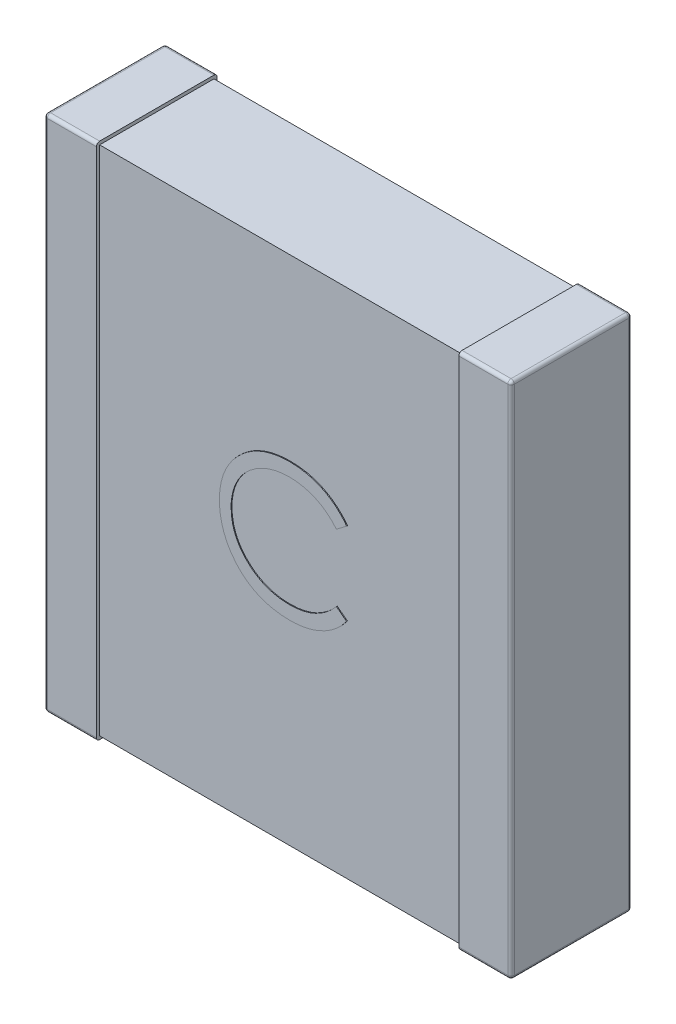
from build123d import *

# Parameters (mm, degrees)
EXTRUDE_1_DEPTH        = 1.44
EXTRUDE_1_DEPTH_BACK   = 0.04
SKETCH_3_W             = 0.64
SKETCH_3_H             = 6.35
EXTRUDE_1_2_DEPTH      = 1.44
EXTRUDE_1_2_DEPTH_BACK = 0.04
SKETCH_5_W             = 1.4
SKETCH_5_H             = 6.27
EXTRUDE_3_DEPTH        = 2.28
FILLET_3_R             = 0.04
EXTRUDE_4_DEPTH        = 0.01


with BuildPart() as part:
    # 草图3 → 凸台-拉伸1 (new, two sides: drawn at the far end of the back side and taken through both)
    with BuildSketch(Plane.XY.offset(-EXTRUDE_1_DEPTH_BACK)):
        with Locations((-2.54, 0)):
            Rectangle(SKETCH_3_W, SKETCH_3_H)
    extrude(amount=EXTRUDE_1_DEPTH + EXTRUDE_1_DEPTH_BACK)



with BuildPart() as body_2:
    # 草图3 → Extrude 1 2 (new, two sides: drawn at the far end of the back side and taken through both)
    with BuildSketch(Plane.XY.offset(-EXTRUDE_1_2_DEPTH_BACK)):
        with Locations((2.54, 0)):
            Rectangle(SKETCH_3_W, SKETCH_3_H)
    extrude(amount=EXTRUDE_1_2_DEPTH + EXTRUDE_1_2_DEPTH_BACK)


with BuildPart() as part_1:
    add(part.part)

    add(body_2.part)  # 凸台-拉伸3 merges body 2
    # 草图5 → 凸台-拉伸3 (add, symmetric)
    with BuildSketch(Plane(origin=(0, 0, 0), x_dir=(0, 0, -1), z_dir=(1, 0, 0))):
        with Locations((-0.7, 0)):
            Rectangle(SKETCH_5_W, SKETCH_5_H)
    extrude(amount=EXTRUDE_3_DEPTH, both=True)

    # 圆角3
    fillet_3_edges = [part_1.edges().sort_by_distance(p)[0] for p in [
        (-2.86, 0, -0.04),
        (-2.54, 3.175, 1.44),
        (-2.54, -3.175, -0.04),
        (-2.86, 0, 1.44),
        (-2.54, -3.175, 1.44),
        (2.86, 3.175, 0.7),
        (2.86, 0, -0.04),
        (2.86, -3.175, 0.7),
        (2.54, -3.175, -0.04),
        (2.54, 3.175, -0.04),
        (2.86, 0, 1.44),
        (2.54, 3.175, 1.44),
        (2.54, -3.175, 1.44),
        (-2.54, 3.175, -0.04),
        (-2.86, -3.175, 0.7),
        (-2.86, 3.175, 0.7),
    ]]
    fillet(fillet_3_edges, radius=FILLET_3_R)

    # 草图6 → 凸台-拉伸4 (add)
    with BuildSketch(Plane.XY.offset(1.4)):
        with BuildLine():
            Line((0.816058378, 0.613216546), (0.690417352, 0.5170627))
            add(Edge.make_bspline(
                [(0.690417352, 0.5170627), (0.681454661, 0.527744286), (0.663650113, 0.548963447), (0.635005907, 0.578759811), (0.605153727, 0.606675359), (0.574104986, 0.632843075), (0.541300817, 0.656347882), (0.50753588, 0.678414672), (0.472245345, 0.69819421), (0.423444553, 0.722177289), (0.359605536, 0.747204103), (0.279242181, 0.768188437), (0.195351393, 0.781546689), (0.138118205, 0.782993473), (0.109007096, 0.783729366)],
                knots=[0, 0, 0, 0, 0.757959112, 1.505699292, 2.245454638, 2.979532153, 3.711538275, 4.438200793, 5.171680507, 5.909471876, 7.393775596, 8.890124382, 10.418191784, 12, 12, 12, 12], degree=3))
            add(Edge.make_bspline(
                [(0.109007096, 0.783729366), (0.092969016, 0.783544698), (0.061041705, 0.783177075), (0.013659546, 0.778327189), (-0.032837849, 0.771510636), (-0.078420233, 0.761396202), (-0.123029586, 0.748608719), (-0.166957541, 0.73332853), (-0.209568101, 0.71442346), (-0.251450724, 0.693528256), (-0.291578363, 0.669927138), (-0.329546385, 0.644183892), (-0.365216313, 0.61658659), (-0.398616365, 0.587031799), (-0.429780684, 0.555652617), (-0.458483455, 0.522114632), (-0.484625356, 0.486525067), (-0.508724568, 0.449353224), (-0.530307532, 0.410707376), (-0.548378334, 0.370444487), (-0.564380675, 0.32925404), (-0.577043186, 0.286670652), (-0.587065822, 0.242993959), (-0.593981326, 0.198106742), (-0.598776055, 0.152102774), (-0.59914185, 0.120921374), (-0.599326237, 0.105203725)],
                knots=[0, 0, 0, 0, 1.054917814, 2.100044995, 3.131103042, 4.146048494, 5.169673617, 6.183595914, 7.203665975, 8.234915748, 9.262203917, 10.264457458, 11.251630812, 12.227803204, 13.197192746, 14.159520551, 15.12972552, 16.100847026, 17.073214652, 18.039054194, 19.002613845, 19.979014051, 20.95965708, 21.949030935, 22.966165397, 24, 24, 24, 24], degree=3))
            add(Edge.make_bspline(
                [(-0.599326237, 0.105203725), (-0.598749406, 0.081555122), (-0.597616874, 0.035124226), (-0.587537635, -0.032885196), (-0.572221022, -0.098037504), (-0.54926533, -0.159925432), (-0.520959478, -0.21931211), (-0.485192341, -0.275192728), (-0.443767638, -0.328411729), (-0.396099332, -0.377711363), (-0.343799531, -0.422746208), (-0.2876862, -0.462403617), (-0.227899097, -0.495461849), (-0.165098352, -0.522970853), (-0.0988007, -0.544116786), (-0.029125361, -0.559003242), (0.043776122, -0.568713953), (0.093590705, -0.569643639), (0.118942993, -0.570116787)],
                knots=[0, 0, 0, 0, 1.029171465, 2.020641659, 2.987623507, 3.938342917, 4.889210282, 5.84687017, 6.821220943, 7.821438502, 8.827599549, 9.822697543, 10.807740252, 11.797342354, 12.80366471, 13.83203677, 14.896651826, 16, 16, 16, 16], degree=3))
            add(Edge.make_bspline(
                [(0.118942993, -0.570116787), (0.146875651, -0.569344774), (0.201853804, -0.567825266), (0.282479187, -0.554952467), (0.359661252, -0.534080276), (0.433404148, -0.504869797), (0.503499987, -0.466897094), (0.57005846, -0.420863779), (0.633135749, -0.366331969), (0.671065478, -0.324693968), (0.690417352, -0.303450121)],
                knots=[0, 0, 0, 0, 1.028121516, 2.023589091, 2.998037872, 3.967518031, 4.937445131, 5.927275754, 6.942489185, 8, 8, 8, 8], degree=3))
            Line((0.690417352, -0.303450121), (0.816058378, -0.398642428))
            add(Edge.make_bspline(
                [(0.816058378, -0.398642428), (0.805947242, -0.411688578), (0.785773402, -0.437718386), (0.75310688, -0.474414025), (0.718694401, -0.508930156), (0.682280362, -0.540988497), (0.644283658, -0.571230538), (0.604022029, -0.59879709), (0.562024757, -0.624072923), (0.518434138, -0.647216659), (0.473296487, -0.667750258), (0.426665888, -0.685329123), (0.378743339, -0.70047193), (0.329526649, -0.712929958), (0.278913732, -0.722653882), (0.22708723, -0.729154305), (0.173935287, -0.733607752), (0.138076351, -0.734013656), (0.119904532, -0.734219352)],
                knots=[0, 0, 0, 0, 0.986787822, 1.968848986, 2.935600012, 3.899624008, 4.868462664, 5.837806735, 6.815139263, 7.798259679, 8.787526145, 9.778297419, 10.776456485, 11.791383307, 12.812564526, 13.85620153, 14.913611965, 16, 16, 16, 16], degree=3))
            add(Edge.make_bspline(
                [(0.119904532, -0.734219352), (0.102695998, -0.734099583), (0.068668254, -0.733862757), (0.018428825, -0.730026338), (-0.030480698, -0.724792172), (-0.077920527, -0.716910969), (-0.124149544, -0.7076107), (-0.168748668, -0.69514384), (-0.212156764, -0.681178506), (-0.254199434, -0.664764798), (-0.29491244, -0.646243115), (-0.334164468, -0.62530983), (-0.371937466, -0.602140978), (-0.408602801, -0.577247259), (-0.443618839, -0.549829064), (-0.477289022, -0.520267174), (-0.509802154, -0.488661226), (-0.529917667, -0.465870436), (-0.540031366, -0.454411659)],
                knots=[0, 0, 0, 0, 1.114604814, 2.203992996, 3.262667896, 4.300477797, 5.318619304, 6.316056647, 7.298880507, 8.271930387, 9.238335007, 10.195173496, 11.151986948, 12.108099108, 13.064862484, 14.031167946, 15.010108607, 16, 16, 16, 16], degree=3))
            add(Edge.make_bspline(
                [(-0.540031366, -0.454411659), (-0.556230517, -0.434507116), (-0.588433249, -0.394938334), (-0.629633562, -0.3308076), (-0.664901015, -0.263850704), (-0.693415722, -0.193715879), (-0.715707257, -0.120560502), (-0.731150089, -0.044347696), (-0.741185108, 0.034851363), (-0.742332669, 0.08871961), (-0.742915981, 0.116101161)],
                knots=[0, 0, 0, 0, 0.994628077, 1.977248131, 2.950237994, 3.925870899, 4.908910175, 5.911660606, 6.938484602, 8, 8, 8, 8], degree=3))
            add(Edge.make_bspline(
                [(-0.742915981, 0.116101161), (-0.742205035, 0.144880797), (-0.740806294, 0.201502934), (-0.728922502, 0.284599599), (-0.709805338, 0.364211667), (-0.682652475, 0.440190521), (-0.648227171, 0.512935792), (-0.605700719, 0.581891772), (-0.555567168, 0.647499451), (-0.498219709, 0.708763338), (-0.435331784, 0.764781327), (-0.367986041, 0.814064163), (-0.296314293, 0.855077885), (-0.221106133, 0.889361845), (-0.141798393, 0.9157136), (-0.058560281, 0.934160771), (0.028451794, 0.945642881), (0.087817475, 0.947094405), (0.117981455, 0.947831931)],
                knots=[0, 0, 0, 0, 1.032925535, 2.032216505, 3.007276963, 3.968222605, 4.92396291, 5.891752235, 6.871517503, 7.883894988, 8.900124299, 9.891468569, 10.874487609, 11.85992873, 12.854644235, 13.869047385, 14.917252991, 16, 16, 16, 16], degree=3))
            add(Edge.make_bspline(
                [(0.117981455, 0.947831931), (0.136365214, 0.947611525), (0.172754012, 0.947175253), (0.226583796, 0.942921017), (0.278991717, 0.935829082), (0.33001388, 0.926176022), (0.379898505, 0.914195532), (0.428264329, 0.898588538), (0.475395158, 0.880743267), (0.520993744, 0.860190825), (0.56484131, 0.837120315), (0.606924198, 0.811787459), (0.646908134, 0.784223662), (0.685074465, 0.754663353), (0.720784733, 0.722481155), (0.755052837, 0.688562254), (0.786715044, 0.651929648), (0.806259362, 0.626144536), (0.816058378, 0.613216546)],
                knots=[0, 0, 0, 0, 1.096760587, 2.17092713, 3.219439832, 4.250915756, 5.268269357, 6.278326846, 7.281116186, 8.274029601, 9.260640565, 10.235837813, 11.203064059, 12.156899882, 13.114053108, 14.069676657, 15.032185724, 16, 16, 16, 16], degree=3))
        make_face()
    extrude(amount=EXTRUDE_4_DEPTH)


solid = part_1.part
